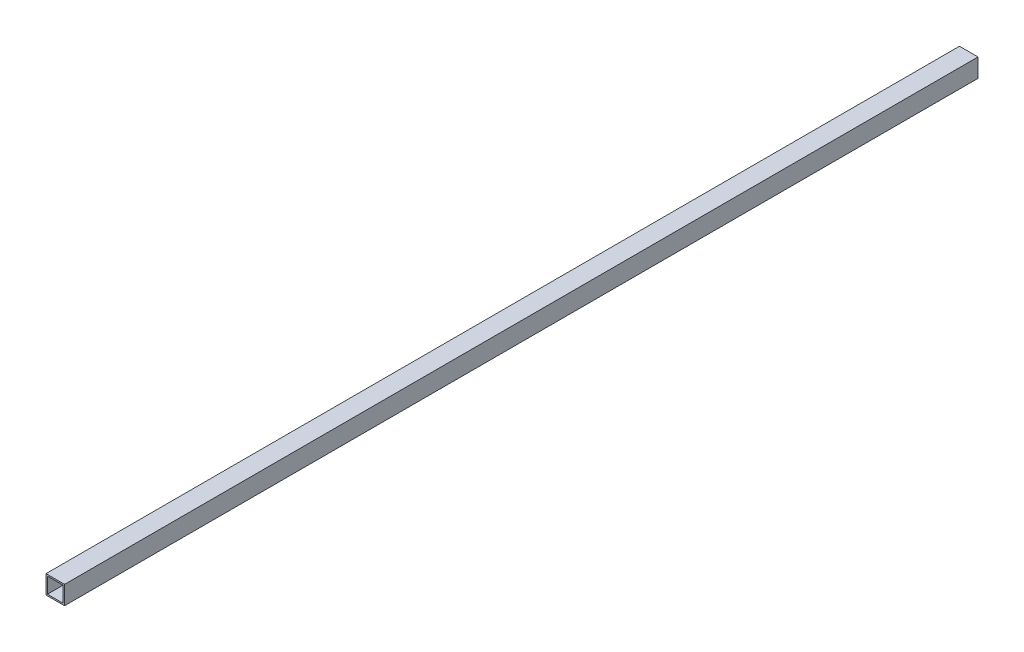
from build123d import *

# Parameters (mm, degrees)
SKETCH_1_W          = 25.4
SKETCH_1_H          = 25.4
EXTRUDE_1_DEPTH     = 1250
SKETCH_1_3_W        = 21.4
SKETCH_1_3_H        = 21.4
CUT_EXTRUDE_1_DEPTH = 1251.129025341


with BuildPart() as part:
    # 草圖1 → 填料-伸長1 (new body)
    with BuildSketch(Plane.XY):
        Rectangle(SKETCH_1_W, SKETCH_1_H)
    extrude(amount=EXTRUDE_1_DEPTH)

    # 草圖1<3> → 除料-伸長1 (cut, through all)
    with BuildSketch(Plane.XY):
        Rectangle(SKETCH_1_3_W, SKETCH_1_3_H)
    extrude(amount=CUT_EXTRUDE_1_DEPTH, mode=Mode.SUBTRACT)


solid = part.part
